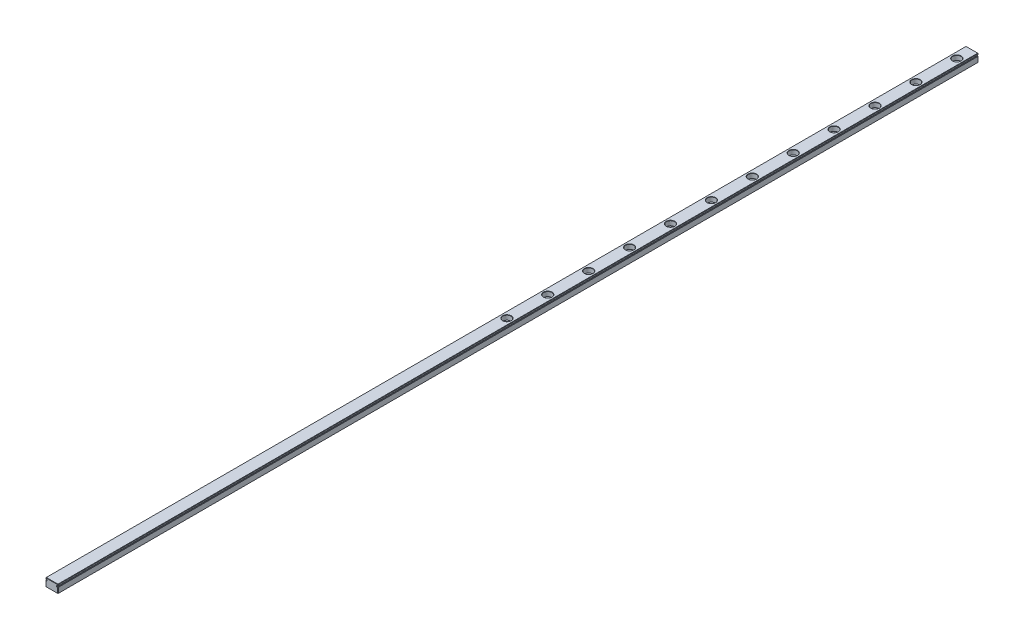
from build123d import *

# Parameters (mm, degrees)
BOSS_EXTRUDE1_DEPTH = 900
CHAMFER1_SIZE       = 0.3
LPATTERN1_COUNT     = 12
LPATTERN1_PITCH     = 40


with BuildPart() as part:
    # Sketch1 → Boss-Extrude1 (new body)
    with BuildSketch(Plane.XY):
        with BuildLine():
            Line((0, 8), (12, 8))
            Line((12, 8), (12, 6.75))
            Line((12, 6.75), (12, 6.559016994))
            ThreePointArc((12, 6.559016994), (11.706107374, 6.475528258), (11.5, 6.25))
            Line((11.5, 6.25), (11, 6.25))
            Line((11, 6.25), (11, 5.75))
            Line((11, 5.75), (11.5, 5.75))
            ThreePointArc((11.5, 5.75), (11.706107374, 5.524471742), (12, 5.440983006))
            Line((12, 5.440983006), (12, 5.25))
            Line((12, 5.25), (12, 0))
            Line((12, 0), (0, 0))
            Line((0, 0), (0, 5.25))
            Line((0, 5.25), (0, 5.440983006))
            ThreePointArc((0, 5.440983006), (0.293892626, 5.524471742), (0.5, 5.75))
            Line((0.5, 5.75), (1, 5.75))
            Line((1, 5.75), (1, 6.25))
            Line((1, 6.25), (0.5, 6.25))
            ThreePointArc((0.5, 6.25), (0.293892626, 6.475528258), (0, 6.559016994))
            Line((0, 6.559016994), (0, 6.75))
            Line((0, 6.75), (0, 8))
        make_face()
    extrude(amount=BOSS_EXTRUDE1_DEPTH)

    # Chamfer1
    chamfer1_edges = [part.edges().sort_by_distance(p)[0] for p in [
        (12, 2.720491503, 900),
        (11.706107374, 5.524471742, 900),
        (0, 2.720491503, 0),
        (0.293892626, 5.524471742, 0),
        (0.75, 5.75, 0),
        (1, 6, 0),
        (0.75, 6.25, 0),
        (11.25, 5.75, 900),
        (0.293892626, 6.475528258, 0),
        (0, 7.279508497, 0),
        (6, 8, 0),
        (12, 7.279508497, 0),
        (11.706107374, 6.475528258, 0),
        (11, 6, 900),
        (11.25, 6.25, 0),
        (11, 6, 0),
        (11.25, 5.75, 0),
        (11.706107374, 5.524471742, 0),
        (12, 2.720491503, 0),
        (6, 0, 0),
        (11.25, 6.25, 900),
        (11.706107374, 6.475528258, 900),
        (12, 7.279508497, 900),
        (0, 8, 450),
        (12, 8, 450),
        (12, 0, 450),
        (0, 0, 450),
        (6, 8, 900),
        (0, 2.720491503, 900),
        (0, 7.279508497, 900),
        (0.293892626, 6.475528258, 900),
        (0.75, 6.25, 900),
        (1, 6, 900),
        (0.75, 5.75, 900),
        (0.293892626, 5.524471742, 900),
        (6, 0, 900),
    ]]
    chamfer(chamfer1_edges, length=CHAMFER1_SIZE)

    # Sketch3 → CBORE for M5 Hex Head Bolt1 (revolve, cut)
    with BuildSketch(Plane(origin=(6, 8, 15), x_dir=(0, 0, 1), z_dir=(1, 0, 0))):
        Polygon((0, 0), (0, 8), (2.5, 8), (2.25, 7.75), (2.25, 4.5), (4, 4.5), (4, 0.25), (4.25, 0), align=None)
    cbore_for_m5_hex_head_bolt1 = revolve(axis=Axis((6, 14.35, 15), (0, -1, 0)), mode=Mode.SUBTRACT)

    # LPattern1: CBORE for M5 Hex Head Bolt1 ×12
    with Locations(*[(0, 0, i * LPATTERN1_PITCH) for i in range(1, LPATTERN1_COUNT)]):
        add(cbore_for_m5_hex_head_bolt1, mode=Mode.SUBTRACT)


solid = part.part
